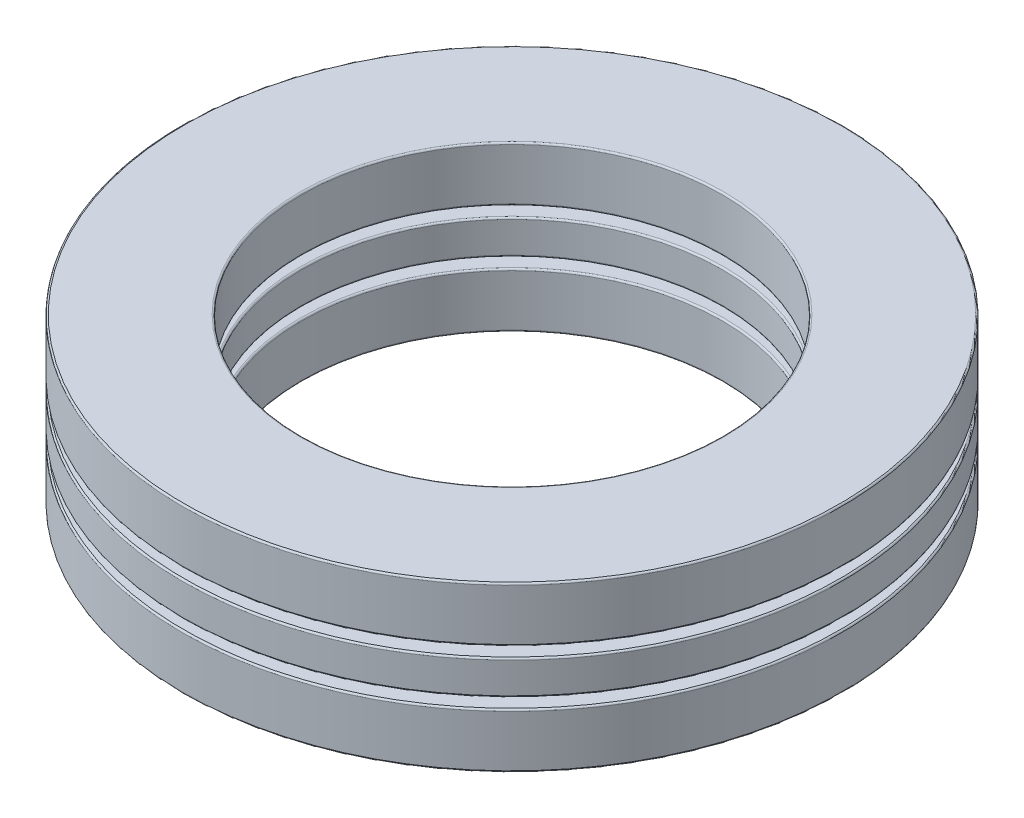
from build123d import *

# Parameters (mm, degrees)
SKETCH1_W         = 6.3119
SKETCH1_H         = 1.80975
CIRPATTERN1_COUNT = 7
CIRPATTERN1_ANGLE = 308.571428571
CIRPATTERN2_COUNT = 7
SKETCH4_W         = 6.3119
SKETCH4_H         = 2.8956
FILLET1_R         = 0.086868
FILLET2_R         = 0.086868
FILLET3_R         = 0.086868


with BuildPart() as part:
    # Sketch1 → Revolve1 (revolve)
    with BuildSketch(Plane(origin=(0, 0, 0), x_dir=(0, 0, -1), z_dir=(1, 0, 0)), mode=Mode.PRIVATE) as revolve1_sk:
        with Locations((-14.30655, 0)):
            Rectangle(SKETCH1_W, SKETCH1_H)
    revolve(revolve1_sk.sketch.rotate(Axis((0, -4.3434, 0), (0, 1, 0)), 180), axis=Axis((0, -4.3434, 0), (0, 1, 0)))

    # Sketch3 → Cut-Revolve1 (revolve, cut)
    with BuildSketch(Plane(origin=(0, 0, 0), x_dir=(0, 0, -1), z_dir=(1, 0, 0))):
        with BuildLine():
            Line((-14.30655, 1.4478), (-14.30655, -1.4478))
            ThreePointArc((-14.30655, -1.4478), (-15.75435, 0), (-14.30655, 1.4478))
        make_face()
    cut_revolve1 = revolve(axis=Axis((0, 1.4478, 14.30655), (0, -1, 0)), mode=Mode.SUBTRACT)

    # CirPattern2: Cut-Revolve1 ×7 about axis
    cirpattern2_axis = Axis((0, 0, 0), (0, 1, 0))
    for i in range(1, CIRPATTERN2_COUNT):
        add(cut_revolve1.rotate(cirpattern2_axis, i * 360 / CIRPATTERN2_COUNT), mode=Mode.SUBTRACT)

    # Fillet2
    fillet2_edges = [part.edges().sort_by_distance(p)[0] for p in [
        (0, 0.904875, 17.4625),
        (0, 0.904875, 11.1506),
        (0, -0.904875, 11.1506),
        (0, -0.904875, 17.4625),
    ]]
    fillet(fillet2_edges, radius=FILLET2_R)


with BuildPart() as body_2:
    # Sketch2 → Revolve2 (revolve)
    with BuildSketch(Plane(origin=(0, 0, 0), x_dir=(0, 0, -1), z_dir=(1, 0, 0))):
        with BuildLine():
            Line((-14.30655, 1.4478), (-14.30655, -1.4478))
            ThreePointArc((-14.30655, -1.4478), (-15.75435, 0), (-14.30655, 1.4478))
        make_face()
    revolve(axis=Axis((0, 1.4478, 14.30655), (0, -1, 0)))


with BuildPart() as cirpattern1_1:
    # CirPattern1: pattern copy
    add(body_2.part.rotate(Axis((0, 4.3434, 0), (0, -1, 0)), 1 * CIRPATTERN1_ANGLE / (CIRPATTERN1_COUNT - 1)))


with BuildPart() as cirpattern1_2:
    # CirPattern1: pattern copy
    add(body_2.part.rotate(Axis((0, 4.3434, 0), (0, -1, 0)), 2 * CIRPATTERN1_ANGLE / (CIRPATTERN1_COUNT - 1)))


with BuildPart() as cirpattern1_3:
    # CirPattern1: pattern copy
    add(body_2.part.rotate(Axis((0, 4.3434, 0), (0, -1, 0)), 3 * CIRPATTERN1_ANGLE / (CIRPATTERN1_COUNT - 1)))


with BuildPart() as cirpattern1_4:
    # CirPattern1: pattern copy
    add(body_2.part.rotate(Axis((0, 4.3434, 0), (0, -1, 0)), 4 * CIRPATTERN1_ANGLE / (CIRPATTERN1_COUNT - 1)))


with BuildPart() as cirpattern1_5:
    # CirPattern1: pattern copy
    add(body_2.part.rotate(Axis((0, 4.3434, 0), (0, -1, 0)), 5 * CIRPATTERN1_ANGLE / (CIRPATTERN1_COUNT - 1)))


with BuildPart() as cirpattern1_6:
    # CirPattern1: pattern copy
    add(body_2.part.rotate(Axis((0, 4.3434, 0), (0, -1, 0)), 6 * CIRPATTERN1_ANGLE / (CIRPATTERN1_COUNT - 1)))


with BuildPart() as body_9:
    # Sketch4 → Revolve3 (revolve)
    with BuildSketch(Plane(origin=(0, 0, 0), x_dir=(0, 0, -1), z_dir=(1, 0, 0)), mode=Mode.PRIVATE) as revolve3_sk:
        with Locations((-14.30655, 2.8956)):
            Rectangle(SKETCH4_W, SKETCH4_H)
        with Locations((-14.30655, -2.8956)):
            Rectangle(SKETCH4_W, SKETCH4_H)
    revolve(revolve3_sk.sketch.rotate(Axis((0, -4.3434, 0), (0, 1, 0)), 180), axis=Axis((0, -4.3434, 0), (0, 1, 0)))

    # Fillet1
    fillet1_edges = [body_9.edges().sort_by_distance(p)[0] for p in [
        (0, 1.4478, 17.4625),
        (0, 1.4478, 11.1506),
        (0, 4.3434, 11.1506),
        (0, 4.3434, 17.4625),
    ]]
    fillet(fillet1_edges, radius=FILLET1_R)

    # Fillet3
    fillet3_edges = [body_9.edges().sort_by_distance(p)[0] for p in [
        (0, -4.3434, 17.4625),
        (0, -4.3434, 11.1506),
        (0, -1.4478, 11.1506),
        (0, -1.4478, 17.4625),
    ]]
    fillet(fillet3_edges, radius=FILLET3_R)


solid = Compound([part.part, body_2.part, cirpattern1_1.part, cirpattern1_2.part, cirpattern1_3.part, cirpattern1_4.part, cirpattern1_5.part, cirpattern1_6.part, body_9.part])
